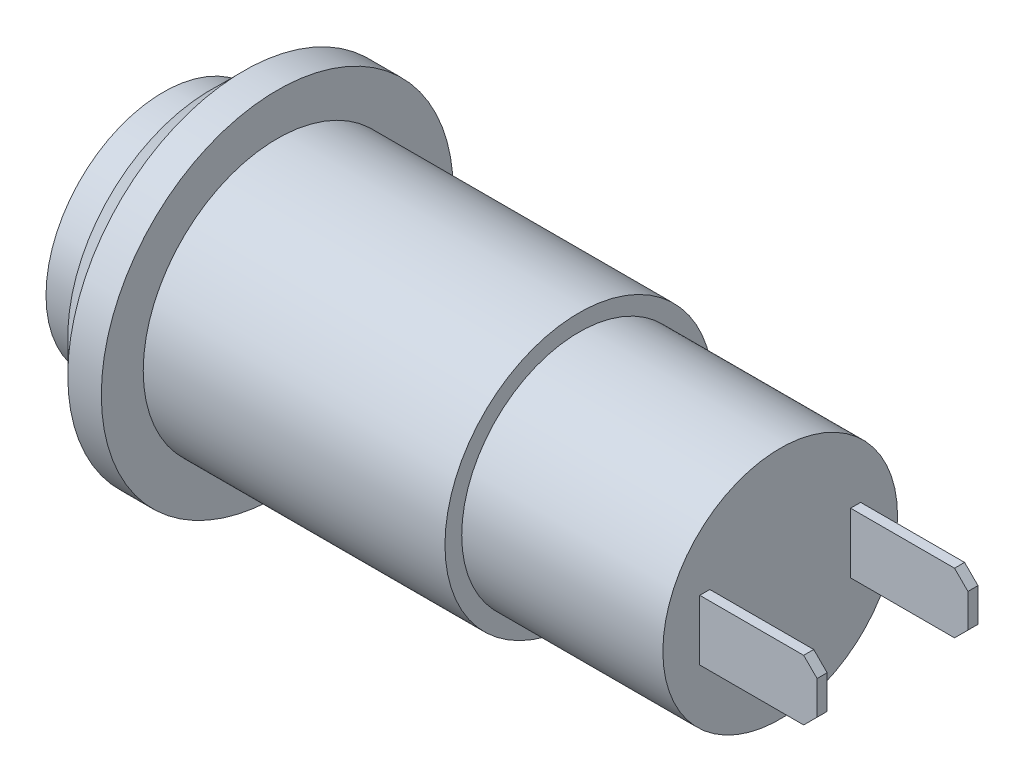
from build123d import *

# Parameters (mm, degrees)
CHAMFER_1_SIZE  = 1
SKETCH_4_W      = 0.3
SKETCH_4_H      = 1.8
EXTRUDE_1_DEPTH = 3.5
CHAMFER_2_SIZE  = 0.4


with BuildPart() as part:
    # 草图2 → 旋转3 (revolve)
    with BuildSketch(Plane.XY, mode=Mode.PRIVATE) as revolve_3_sk:
        Polygon((18.4, 0), (18.4, 3.5), (12.4, 3.5), (12.4, 4), (3.4, 4), (3.4, 5.25), (1.4, 5.25), (1.4, 3.5), (0, 3.5), (0, 0), align=None)
    revolve(revolve_3_sk.sketch.rotate(Axis((0, 0, 0), (1, 0, 0)), 90), axis=Axis((0, 0, 0), (1, 0, 0)))

    # 倒角1
    chamfer_1_edges = [part.edges().sort_by_distance(p)[0] for p in [
        (1.4, 0, -5.25),
    ]]
    chamfer(chamfer_1_edges, length=CHAMFER_1_SIZE)

    # 草图4 → 凸台-拉伸1 (add)
    with BuildSketch(Plane(origin=(18.4, 0, 0), x_dir=(0, 0, -1), z_dir=(1, 0, 0))):
        with Locations((-2.25, 0)):
            Rectangle(SKETCH_4_W, SKETCH_4_H)
        with Locations((2.25, 0)):
            Rectangle(SKETCH_4_W, SKETCH_4_H)
    extrude(amount=EXTRUDE_1_DEPTH)

    # 倒角2
    chamfer_2_edges = [part.edges().sort_by_distance(p)[0] for p in [
        (21.9, -0.9, 2.25),
        (21.9, 0.9, 2.25),
        (21.9, 0.9, -2.25),
        (21.9, -0.9, -2.25),
    ]]
    chamfer(chamfer_2_edges, length=CHAMFER_2_SIZE)


solid = part.part
